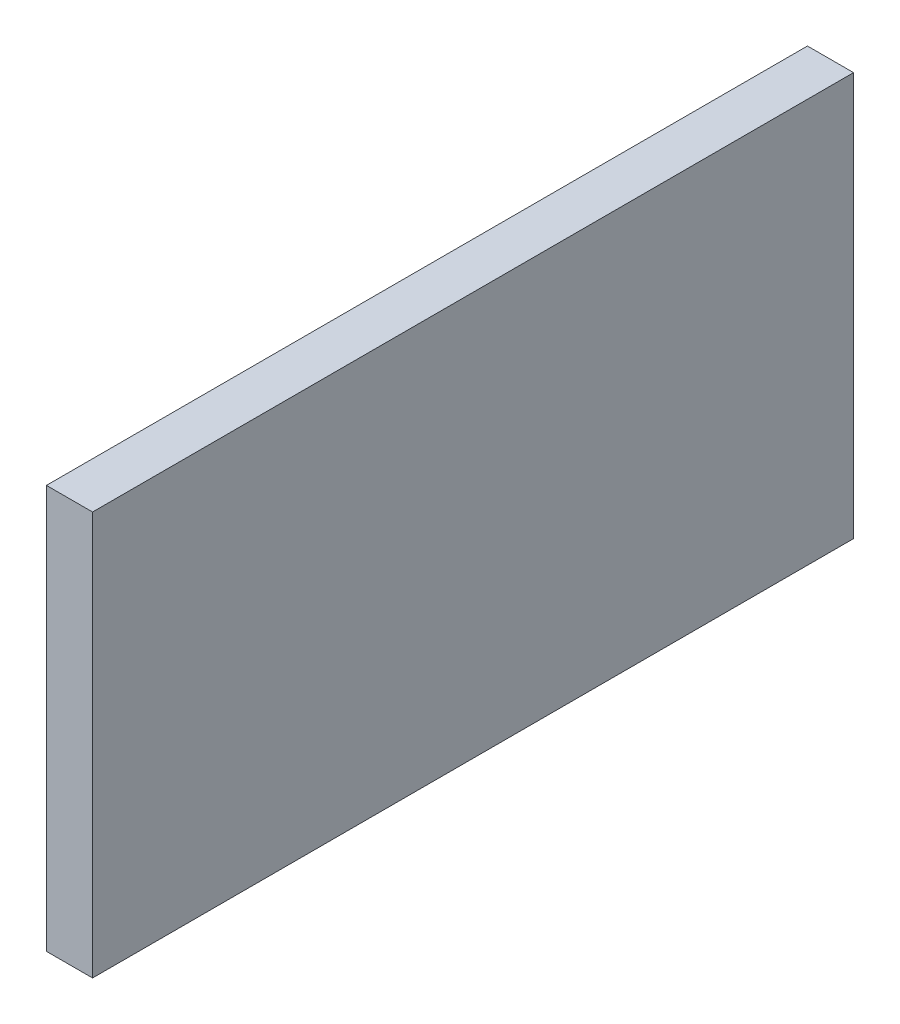
from build123d import *

# Parameters (mm, degrees)
SKETCH1_W     = 4
SKETCH1_H     = 35
PROFILE_DEPTH = 66


with BuildPart() as part:
    # Sketch1 → Profile (new body)
    with BuildSketch(Plane.XY):
        with Locations((2, 17.5)):
            Rectangle(SKETCH1_W, SKETCH1_H)
    extrude(amount=PROFILE_DEPTH)


solid = part.part
